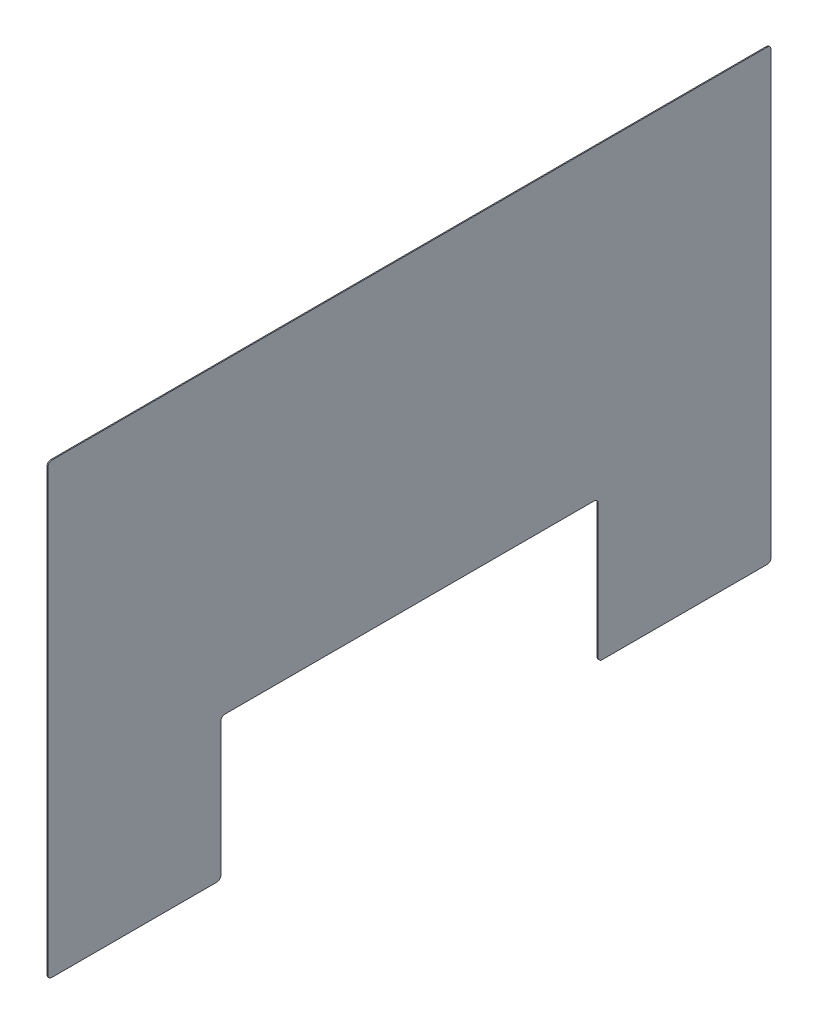
from build123d import *

# Parameters (mm, degrees)
BOSS_EXTRUDE1_DEPTH = 1.5875
FILLET1_R           = 6.35


with BuildPart() as part:
    # Sketch1 → Boss-Extrude1 (new body)
    with BuildSketch(Plane(origin=(0, 0, 0), x_dir=(0, 0, -1), z_dir=(1, 0, 0))):
        Polygon((-304.8, -361.95), (-584.2, -361.95), (-584.2, 361.95), (584.2, 361.95), (584.2, -361.95), (304.8, -361.95), (304.8, -133.35), (-304.8, -133.35), align=None)
    extrude(amount=BOSS_EXTRUDE1_DEPTH)

    # Fillet1
    fillet1_edges = [part.edges().sort_by_distance(p)[0] for p in [
        (0.79375, 361.95, 584.2),
        (0.79375, 361.95, -584.2),
        (0.79375, -361.95, -584.2),
        (0.79375, -361.95, -304.8),
        (0.79375, -133.35, -304.8),
        (0.79375, -133.35, 304.8),
        (0.79375, -361.95, 304.8),
        (0.79375, -361.95, 584.2),
    ]]
    fillet(fillet1_edges, radius=FILLET1_R)


solid = part.part
